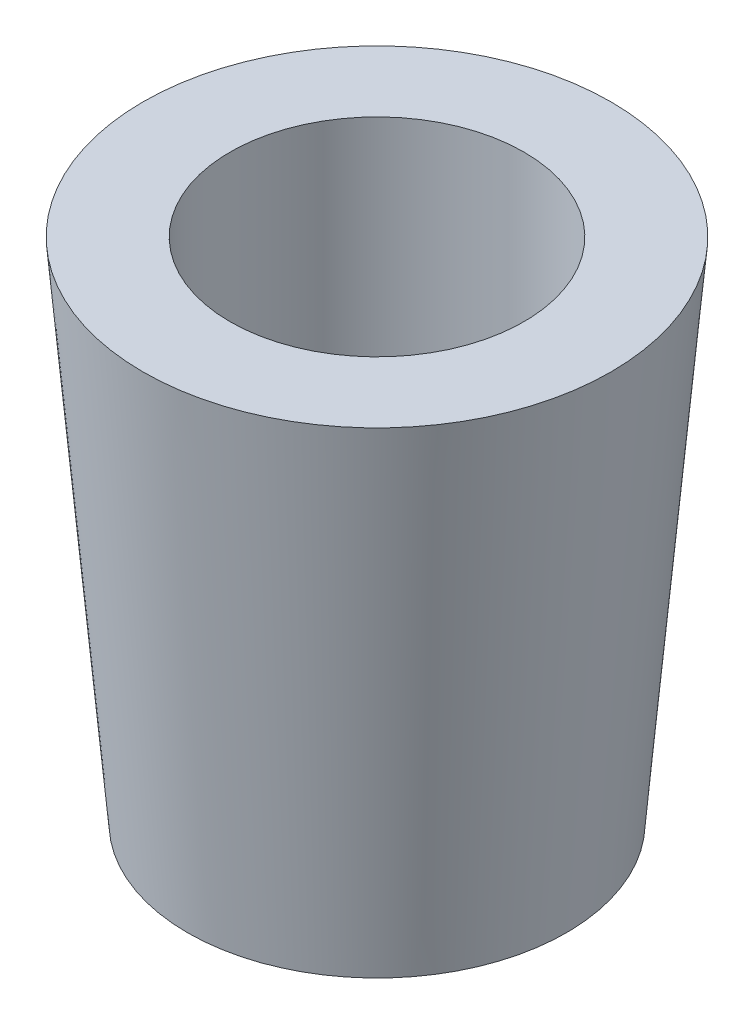
from build123d import *

# Parameters (mm, degrees)
SKETCH1_R           = 11.7
BOSS_EXTRUDE1_DEPTH = 25.4
BOSS_EXTRUDE1_DRAFT = -5
SKETCH2_R           = 3.175
CUT_EXTRUDE1_DEPTH  = 31.314023158
SKETCH9_R           = 7.35
CUT_EXTRUDE3_DEPTH  = 12.7
SKETCH14_R          = 1.75
CUT_EXTRUDE5_DEPTH  = 7.62


with BuildPart() as part:
    # Sketch1 → Boss-Extrude1 (with draft: the straight prism first)
    with BuildSketch(Plane(origin=(0, 0, 0), x_dir=(1, 0, 0), z_dir=(0, 1, 0))):
        Circle(SKETCH1_R)
    extrude(amount=-BOSS_EXTRUDE1_DEPTH)
    # Boss-Extrude1: the draft: its side faces are tilted about the plane it starts from
    boss_extrude1_sides = [part.faces().sort_by_distance(p)[0] for p in [
        (-11.7, -12.7, 0),
    ]]
    draft(boss_extrude1_sides, Plane(origin=(0, 0, 0), x_dir=(1, 0, 0), z_dir=(0, 1, 0)), BOSS_EXTRUDE1_DRAFT)

    # Sketch2 → Cut-Extrude1 (cut, through all)
    with BuildSketch(Plane(origin=(0, 0, 0), x_dir=(1, 0, 0), z_dir=(0, 1, 0))):
        with Locations(Location((0, 0, 0), (0, 0, 270))):
            Circle(SKETCH2_R)
    extrude(amount=-CUT_EXTRUDE1_DEPTH, mode=Mode.SUBTRACT)

    # Sketch9 → Cut-Extrude3 (cut)
    with BuildSketch(Plane(origin=(0, 0, 0), x_dir=(1, 0, 0), z_dir=(0, 1, 0))):
        with Locations(Location((0, 0, 0), (0, 0, 270))):
            Circle(SKETCH9_R)
    extrude(amount=-CUT_EXTRUDE3_DEPTH, mode=Mode.SUBTRACT)

    # Sketch14 → Cut-Extrude5 (cut)
    with BuildSketch(Plane.XZ.offset(25.4)):
        with Locations(Location((-5.826393973, 0, 0), (0, 0, 270))):
            Circle(SKETCH14_R)
        with Locations(Location((0, 5.826393973, 0), (0, 0, 270))):
            Circle(SKETCH14_R)
        with Locations(Location((5.826393973, 0, 0), (0, 0, 270))):
            Circle(SKETCH14_R)
        with Locations(Location((0, -5.826393973, 0), (0, 0, 270))):
            Circle(SKETCH14_R)
    extrude(amount=-CUT_EXTRUDE5_DEPTH, mode=Mode.SUBTRACT)


solid = part.part
